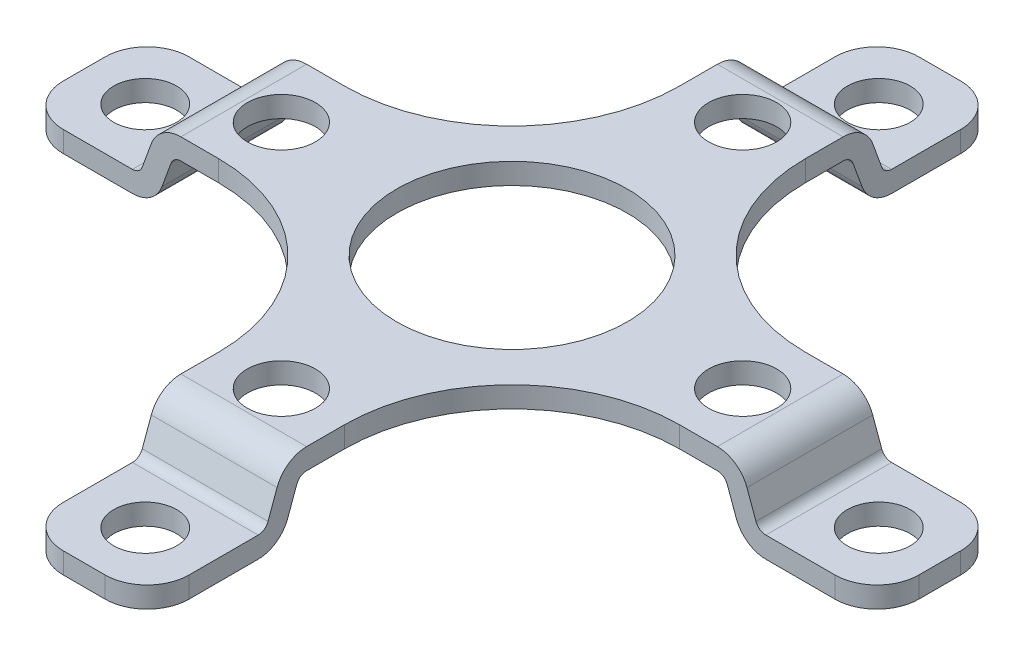
from build123d import *

# Parameters (mm, degrees)
EXTRUDE_THIN1_DEPTH     = 3
FILLET1_R               = 2
FILLET1_OF_MIRROR1_R    = 2
CIRPATTERN1_COUNT       = 2
CIRPATTERN1_ANGLE       = 90
CUT_EXTRUDE1_DEPTH      = 30.075421318
CUT_EXTRUDE1_DEPTH_BACK = 30.075421318
SKETCH3_R               = 1.625
CUT_EXTRUDE2_DEPTH      = 29.972057656
CUT_EXTRUDE2_DEPTH_BACK = 29.972057656
SKETCH4_R               = 1.5
FILLET2_R               = 8
CUT_EXTRUDE3_DEPTH      = 30.075421318
CUT_EXTRUDE3_DEPTH_BACK = 30.075421318
SKETCH5_R               = 5.5


with BuildPart() as part:
    # Sketch1 → Extrude-Thin1 (new, symmetric)
    with BuildSketch(Plane.XY):
        with BuildLine():
            Line((-20.409925586, -3), (-15.110133124, -3))
            ThreePointArc((-15.110133124, -3), (-14.249768469, -2.728728066), (-13.700594193, -2.013030215))
            Line((-13.700594193, -2.013030215), (-13.269638772, -0.828989928))
            ThreePointArc((-13.269638772, -0.828989928), (-13.08658068, -0.590423978), (-12.799792462, -0.5))
            Line((-12.799792462, -0.5), (0, -0.5))
            Line((0, -0.5), (0, 0.5))
            Line((0, 0.5), (-12.799792462, 0.5))
            ThreePointArc((-12.799792462, 0.5), (-13.660157116, 0.228728066), (-14.209331393, -0.486969785))
            Line((-14.209331393, -0.486969785), (-14.640286813, -1.671010072))
            ThreePointArc((-14.640286813, -1.671010072), (-14.823344906, -1.909576022), (-15.110133124, -2))
            Line((-15.110133124, -2), (-20.409925586, -2))
            Line((-20.409925586, -2), (-20.409925586, -3))
        make_face()
    extrude_thin1 = extrude(amount=EXTRUDE_THIN1_DEPTH, both=True)

    # Fillet1
    fillet1_edges = [part.edges().sort_by_distance(p)[0] for p in [
        (-20.409925586, -2.5, -3),
        (-20.409925586, -2.5, 3),
    ]]
    fillet(fillet1_edges, radius=FILLET1_R)

    # Mirror1: Extrude-Thin1 across plane
    add(extrude_thin1.mirror(Plane(origin=(0, 0.5, 3), x_dir=(0, 0, 1), z_dir=(1, 0, 0))))

    # Fillet1 of Mirror1
    fillet1_of_mirror1_edges = [part.edges().sort_by_distance(p)[0] for p in [
        (20.409925586, -2.5, -3),
        (20.409925586, -2.5, 3),
    ]]
    fillet(fillet1_of_mirror1_edges, radius=FILLET1_OF_MIRROR1_R)


with BuildPart() as cirpattern1_1:
    # CirPattern1: pattern copy
    add(part.part.rotate(Axis((0, 0, 0), (0, 1, 0)), 1 * CIRPATTERN1_ANGLE / (CIRPATTERN1_COUNT - 1)))


with BuildPart() as cut_extrude1_tool:
    # Sketch3 → Cut-Extrude1 (new, two sides: drawn at the far end of the back side and taken through both)
    with BuildSketch(Plane(origin=(0, 0.5, 0), x_dir=(1, 0, 0), z_dir=(0, 1, 0)).offset(-CUT_EXTRUDE1_DEPTH_BACK)):
        with Locations(Location((11.005, 0, 0), (0, 0, 270))):
            Circle(SKETCH3_R)
        with Locations(Location((0, -11.005, 0), (0, 0, 270))):
            Circle(SKETCH3_R)
        with Locations(Location((-11.005, 0, 0), (0, 0, 270))):
            Circle(SKETCH3_R)
        with Locations(Location((0, 11.005, 0), (0, 0, 270))):
            Circle(SKETCH3_R)
    extrude(amount=CUT_EXTRUDE1_DEPTH + CUT_EXTRUDE1_DEPTH_BACK)


with BuildPart() as part_1:
    add(part.part)

    # Cut-Extrude1: cut by cut_extrude1_tool
    add(cut_extrude1_tool.part, mode=Mode.SUBTRACT)


with BuildPart() as cirpattern1_1_1:
    add(cirpattern1_1.part)

    # Cut-Extrude1: cut by cut_extrude1_tool
    add(cut_extrude1_tool.part, mode=Mode.SUBTRACT)


with BuildPart() as cut_extrude2_tool:
    # Sketch4 → Cut-Extrude2 (new, two sides: drawn at the far end of the back side and taken through both)
    with BuildSketch(Plane(origin=(0, -2, 0), x_dir=(1, 0, 0), z_dir=(0, 1, 0)).offset(-CUT_EXTRUDE2_DEPTH_BACK)):
        with Locations(Location((-17.5, 0, 0), (0, 0, 180))):
            Circle(SKETCH4_R)
        with Locations(Location((0, 17.5, 0), (0, 0, 180))):
            Circle(SKETCH4_R)
        with Locations(Location((17.5, 0, 0), (0, 0, 180))):
            Circle(SKETCH4_R)
        with Locations(Location((0, -17.5, 0), (0, 0, 180))):
            Circle(SKETCH4_R)
    extrude(amount=CUT_EXTRUDE2_DEPTH + CUT_EXTRUDE2_DEPTH_BACK)


with BuildPart() as part_2:
    add(part_1.part)

    # Cut-Extrude2: cut by cut_extrude2_tool
    add(cut_extrude2_tool.part, mode=Mode.SUBTRACT)


with BuildPart() as cirpattern1_1_2:
    add(cirpattern1_1_1.part)

    # Cut-Extrude2: cut by cut_extrude2_tool
    add(cut_extrude2_tool.part, mode=Mode.SUBTRACT)


with BuildPart() as part_3:
    add(part_2.part)

    # Combine2: union CirPattern1_1
    add(cirpattern1_1_2.part)

    # Fillet2
    fillet2_edges = [part_3.edges().sort_by_distance(p)[0] for p in [
        (-3, 0, -3),
        (3, 0, -3),
        (-3, 0, 3),
        (3, 0, 3),
    ]]
    fillet(fillet2_edges, radius=FILLET2_R)

    # Sketch5 → Cut-Extrude3 (cut, two sides: drawn at the far end of the back side and taken through both)
    with BuildSketch(Plane(origin=(0, 0.5, 0), x_dir=(1, 0, 0), z_dir=(0, 1, 0)).offset(-CUT_EXTRUDE3_DEPTH_BACK)):
        with Locations(Location((0, 0, 0), (0, 0, 270))):
            Circle(SKETCH5_R)
    extrude(amount=CUT_EXTRUDE3_DEPTH + CUT_EXTRUDE3_DEPTH_BACK, mode=Mode.SUBTRACT)


solid = part_3.part
